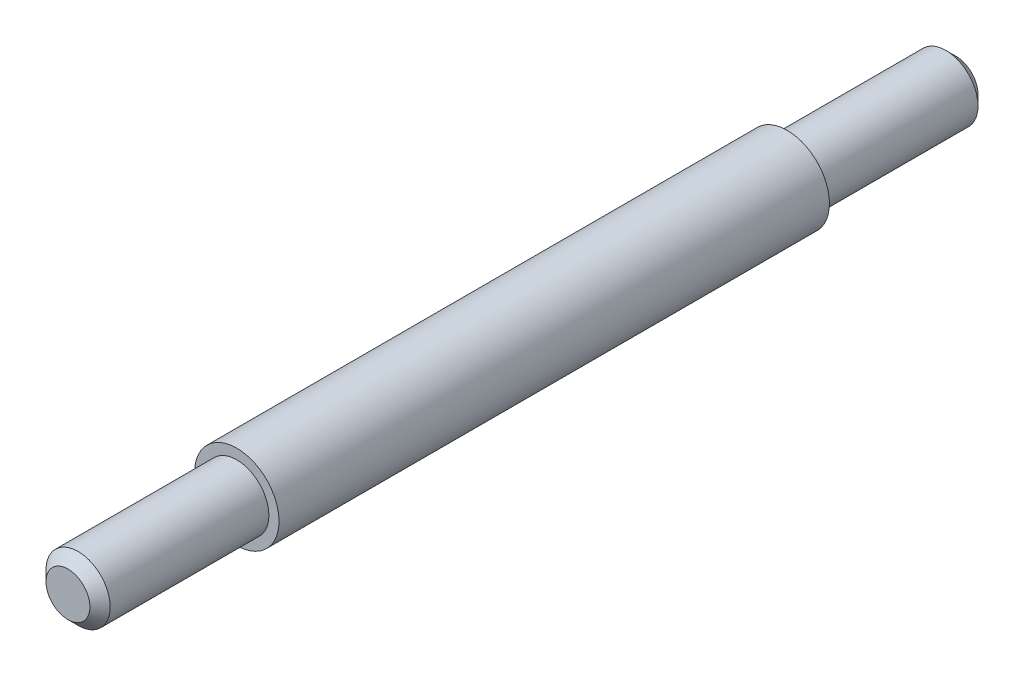
from build123d import *

# Parameters (mm, degrees)
SKETCH1_R           = 0.125
BOSS_EXTRUDE1_DEPTH = 1.63
SKETCH2_R           = 0.095
BOSS_EXTRUDE2_DEPTH = 0.5
BOSS_EXTRUDE3_START = 0.5
SKETCH3_R           = 0.095
BOSS_EXTRUDE3_DEPTH = 0.5
CHAMFER1_SIZE       = 0.03
CHAMFER2_SIZE       = 0.03


with BuildPart() as part:
    # Sketch1 → Boss-Extrude1 (new body)
    with BuildSketch(Plane.XY):
        Circle(SKETCH1_R)
    extrude(amount=BOSS_EXTRUDE1_DEPTH)

    # Sketch2 → Boss-Extrude2 (add)
    with BuildSketch(Plane.XY):
        Circle(SKETCH2_R)
    extrude(amount=-BOSS_EXTRUDE2_DEPTH)

    # Sketch3 → Boss-Extrude3 (add)
    with BuildSketch(Plane.XY.offset(1.63).offset(BOSS_EXTRUDE3_START)):
        Circle(SKETCH3_R)
    extrude(amount=-BOSS_EXTRUDE3_DEPTH)

    # Chamfer1
    chamfer1_edges = [part.edges().sort_by_distance(p)[0] for p in [
        (-0.095, 0, -0.5),
    ]]
    chamfer(chamfer1_edges, length=CHAMFER1_SIZE)

    # Chamfer2
    chamfer2_edges = [part.edges().sort_by_distance(p)[0] for p in [
        (-0.095, 0, 2.13),
    ]]
    chamfer(chamfer2_edges, length=CHAMFER2_SIZE)


solid = part.part
